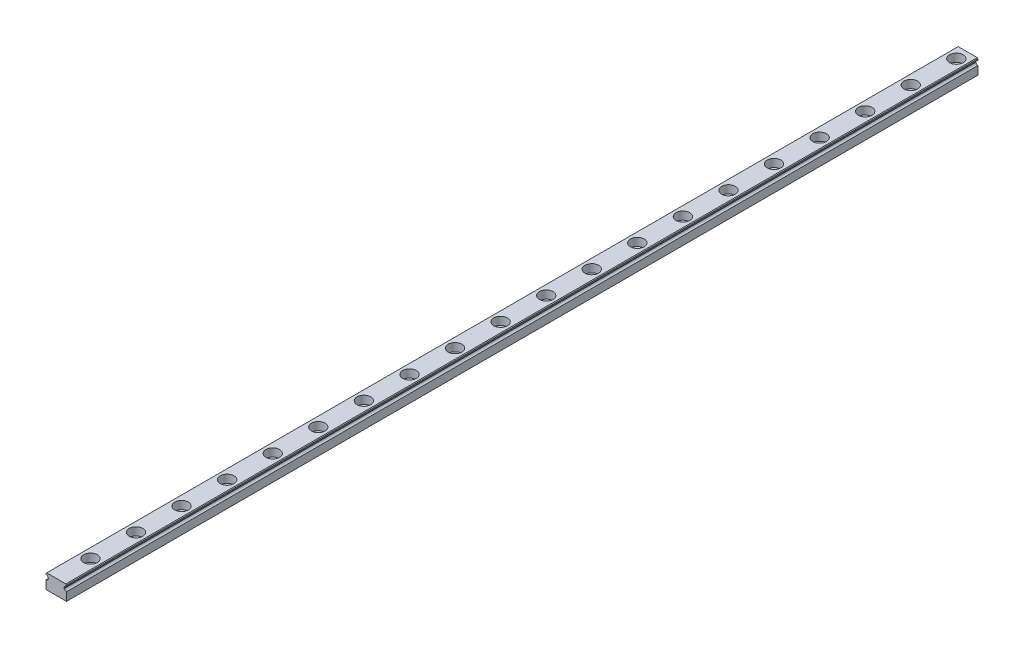
from build123d import *

# Parameters (mm, degrees)
EXTRUDE1_DEPTH  = 400
SKETCH2_R       = 3
EXTRUDE2_DEPTH  = 3.5
SKETCH_R        = 1.75
EXTRUDE3_DEPTH  = 401.078117372
LPATTERN1_COUNT = 40
LPATTERN1_PITCH = 20
CHAMFER1_SIZE   = 0.3


with BuildPart() as part:
    # Sketch1 → Extrude1 (new body)
    with BuildSketch(Plane.XY):
        with BuildLine():
            Line((-4.5, -3.25), (4.5, -3.25))
            Line((4.5, -3.25), (4.5, 0.45))
            ThreePointArc((4.5, 0.45), (3.887627564, 0.659430585), (3.531754163, 1.2))
            Line((3.531754163, 1.2), (3.4, 1.2))
            Line((3.4, 1.2), (3.4, 1.7))
            Line((3.4, 1.7), (3.531754163, 1.7))
            ThreePointArc((3.531754163, 1.7), (3.887627564, 2.240569415), (4.5, 2.45))
            Line((4.5, 2.45), (4.5, 3.25))
            Line((4.5, 3.25), (-4.5, 3.25))
            Line((-4.5, 3.25), (-4.5, 2.45))
            ThreePointArc((-4.5, 2.45), (-3.887627564, 2.240569415), (-3.531754163, 1.7))
            Line((-3.531754163, 1.7), (-3.4, 1.7))
            Line((-3.4, 1.7), (-3.4, 1.2))
            Line((-3.4, 1.2), (-3.531754163, 1.2))
            ThreePointArc((-3.531754163, 1.2), (-3.887627564, 0.659430585), (-4.5, 0.45))
            Line((-4.5, 0.45), (-4.5, -3.25))
        make_face()
    extrude(amount=EXTRUDE1_DEPTH)

    # Sketch2 → Extrude2 (cut)
    with BuildSketch(Plane(origin=(0, 3.25, 0), x_dir=(1, 0, 0), z_dir=(0, 1, 0))):
        with Locations(Location((0, -5, 0), (0, 0, 270))):
            Circle(SKETCH2_R)
    extrude2 = extrude(amount=-EXTRUDE2_DEPTH, mode=Mode.SUBTRACT)

    # Sketch → Extrude3 (cut, through all)
    with BuildSketch(Plane(origin=(0, 3.25, 0), x_dir=(1, 0, 0), z_dir=(0, 1, 0))):
        with Locations(Location((0, -5, 0), (0, 0, 270))):
            Circle(SKETCH_R)
    extrude3 = extrude(amount=-EXTRUDE3_DEPTH, mode=Mode.SUBTRACT)

    # LPattern1: Extrude2, Extrude3 ×40
    with Locations(*[(0, 0, i * LPATTERN1_PITCH) for i in range(1, LPATTERN1_COUNT)]):
        add(extrude2, mode=Mode.SUBTRACT)
        add(extrude3, mode=Mode.SUBTRACT)

    # Chamfer1
    chamfer1_edges = [part.edges().sort_by_distance(p)[0] for p in [
        (-4.5, 3.25, 200),
        (4.5, 3.25, 200),
    ]]
    chamfer(chamfer1_edges, length=CHAMFER1_SIZE)


solid = part.part
